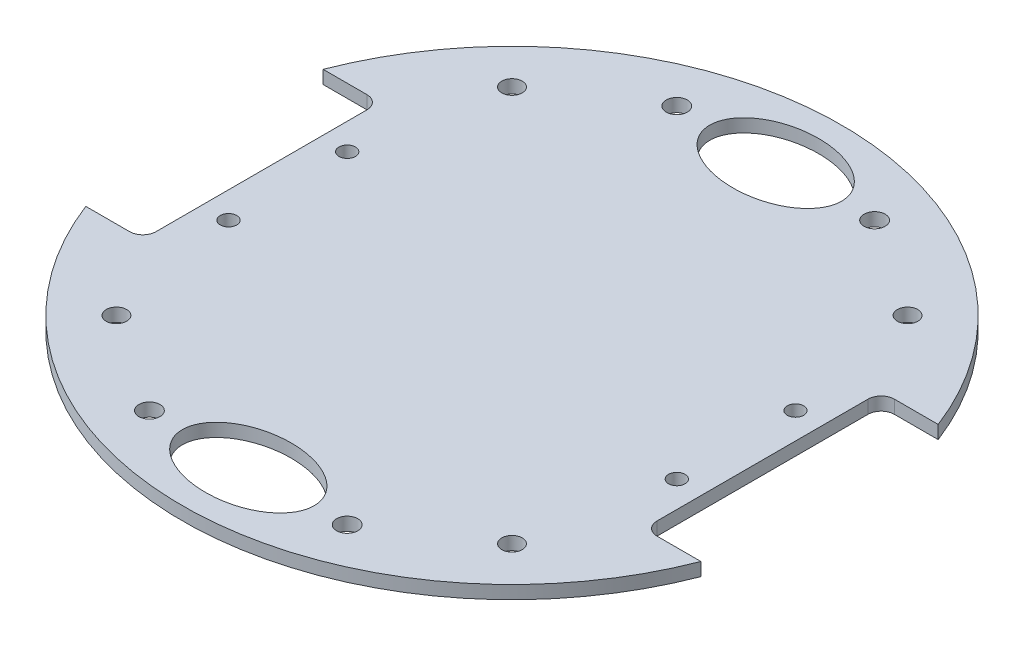
from build123d import *

# Parameters (mm, degrees)
BOSS_EXTRU_1_DEPTH      = 2
ESQUISSE2_RX            = 10
ESQUISSE2_RY            = 6.5
ENL_V_MAT_EXTRU_1_DEPTH = 69.410525506
ESQUISSE3_R             = 1.55
ESQUISSE3_R_2           = 1.6
ESQUISSE3_R_3           = 1.25
ENL_V_MAT_EXTRU_2_DEPTH = 10


with BuildPart() as part:
    # Esquisse1 → Boss.-Extru.1 (new body)
    with BuildSketch(Plane(origin=(0, 0, 0), x_dir=(1, 0, 0), z_dir=(0, 1, 0))):
        with BuildLine():
            Line((-46.647615159, 18), (-40, 18))
            ThreePointArc((-40, 18), (-38.585786438, 17.414213562), (-38, 16))
            Line((-38, 16), (-38, -16))
            ThreePointArc((-38, -16), (-38.585786438, -17.414213562), (-40, -18))
            Line((-40, -18), (-46.647615159, -18))
            ThreePointArc((-46.647615159, -18), (0, -50), (46.647615159, -18))
            Line((46.647615159, -18), (40, -18))
            ThreePointArc((40, -18), (38.585786438, -17.414213562), (38, -16))
            Line((38, -16), (38, 16))
            ThreePointArc((38, 16), (38.585786438, 17.414213562), (40, 18))
            Line((40, 18), (46.647615159, 18))
            ThreePointArc((46.647615159, 18), (0, 50), (-46.647615159, 18))
        make_face()
    extrude(amount=BOSS_EXTRU_1_DEPTH)

    # Esquisse2 → Enlèv. mat.-Extru.1 (cut, through all)
    with BuildSketch(Plane(origin=(0, 2, 0), x_dir=(1, 0, 0), z_dir=(0, 1, 0))):
        with Locations((0, 40)):
            Ellipse(ESQUISSE2_RX, ESQUISSE2_RY)
        with Locations((0, -40)):
            Ellipse(ESQUISSE2_RX, ESQUISSE2_RY)
    extrude(amount=-ENL_V_MAT_EXTRU_1_DEPTH, mode=Mode.SUBTRACT)

    # Esquisse3 → Enlèv. mat.-Extru.2 (cut)
    with BuildSketch(Plane(origin=(0, 2, 0), x_dir=(1, 0, 0), z_dir=(0, 1, 0))):
        with Locations(Location((-30, 30, 0), (0, 0, 270))):
            Circle(ESQUISSE3_R)
        with Locations(Location((30, 30, 0), (0, 0, 90))):
            Circle(ESQUISSE3_R)
        with Locations(Location((30, -30, 0), (0, 0, 270))):
            Circle(ESQUISSE3_R)
        with Locations(Location((-30, -30, 0), (0, 0, 90))):
            Circle(ESQUISSE3_R)
        with Locations(Location((-15, 40, 0), (0, 0, 270))):
            Circle(ESQUISSE3_R_2)
        with Locations(Location((15, 40, 0), (0, 0, 90))):
            Circle(ESQUISSE3_R_2)
        with Locations(Location((15, -40, 0), (0, 0, 270))):
            Circle(ESQUISSE3_R_2)
        with Locations(Location((-15, -40, 0), (0, 0, 90))):
            Circle(ESQUISSE3_R_2)
        with Locations(Location((-34, 9, 0), (0, 0, 270))):
            Circle(ESQUISSE3_R_3)
        with Locations(Location((-34, -9, 0), (0, 0, 90))):
            Circle(ESQUISSE3_R_3)
        with Locations(Location((34, -9, 0), (0, 0, 270))):
            Circle(ESQUISSE3_R_3)
        with Locations(Location((34, 9, 0), (0, 0, 90))):
            Circle(ESQUISSE3_R_3)
    extrude(amount=-ENL_V_MAT_EXTRU_2_DEPTH, mode=Mode.SUBTRACT)


solid = part.part
